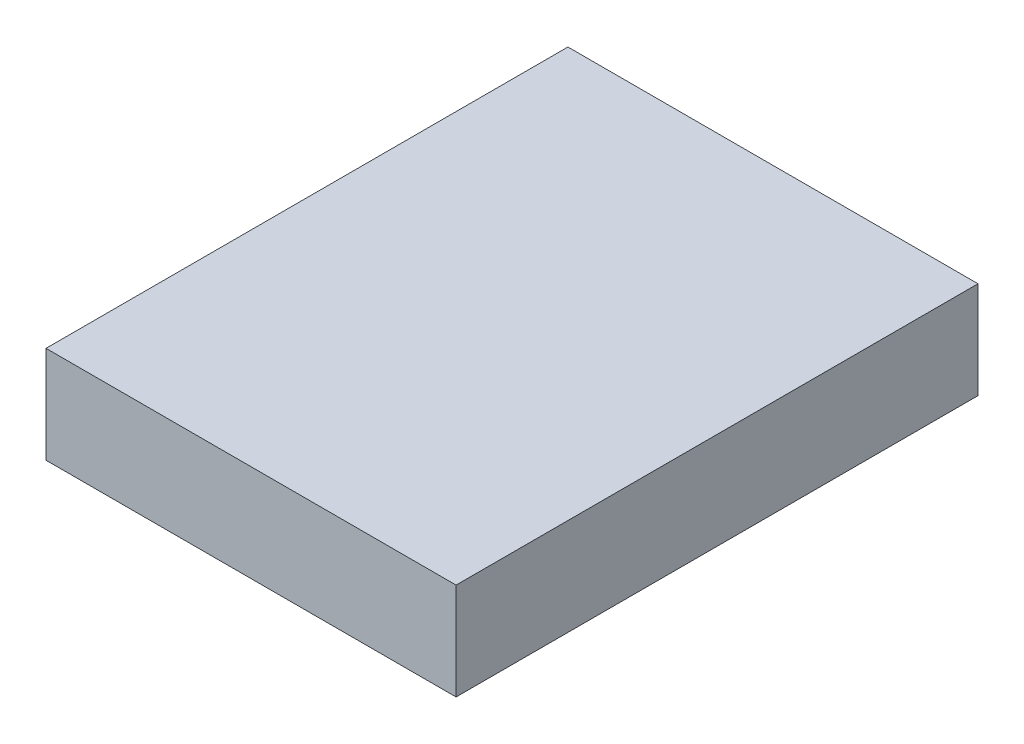
from build123d import *

# Parameters (mm, degrees)
SKETCH1_W           = 55
SKETCH1_H           = 70
BOSS_EXTRUDE1_DEPTH = 13


with BuildPart() as part:
    # Sketch1 → Boss-Extrude1 (new body)
    with BuildSketch(Plane(origin=(0, 0, 0), x_dir=(1, 0, 0), z_dir=(0, 1, 0))):
        with Locations((2.487487854, -1.028160613)):
            Rectangle(SKETCH1_W, SKETCH1_H)
    extrude(amount=BOSS_EXTRUDE1_DEPTH)


solid = part.part
